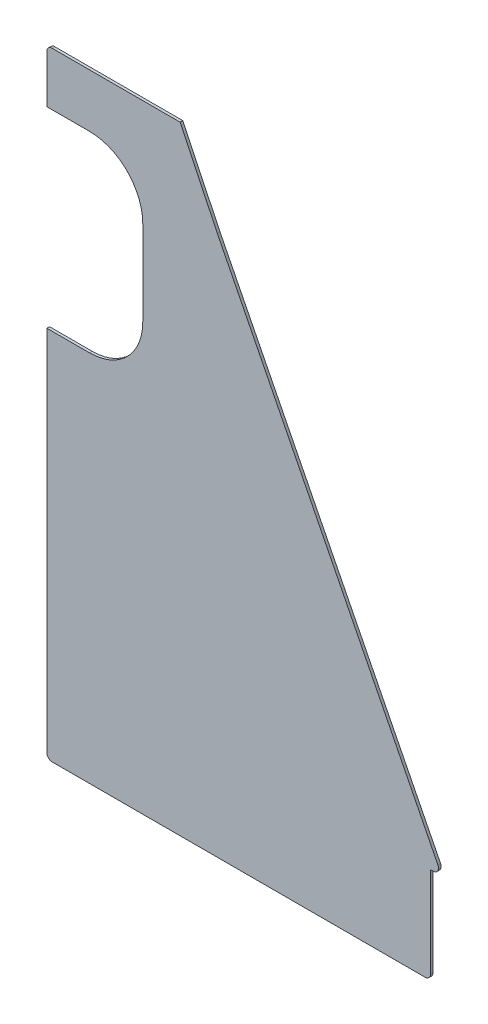
from build123d import *

# Parameters (mm, degrees)
SKETCH1_W           = 720
SKETCH1_H           = 1160
BOSS_EXTRUDE1_DEPTH = 5
FILLET1_R           = 10
CUT_EXTRUDE1_DEPTH  = 683.6602376
SKETCH3_W           = 360
SKETCH3_H           = 360
CUT_EXTRUDE2_DEPTH  = 683.6602376
FILLET2_R           = 100
BOSS_EXTRUDE2_DEPTH = 5
FILLET3_R           = 10


with BuildPart() as part:
    # Sketch1 → Boss-Extrude1 (new body)
    with BuildSketch(Plane.XY):
        Rectangle(SKETCH1_W, SKETCH1_H)
    extrude(amount=BOSS_EXTRUDE1_DEPTH)

    # Fillet1
    fillet1_edges = [part.edges().sort_by_distance(p)[0] for p in [
        (360, -580, 2.5),
        (-360, -580, 2.5),
        (-360, 580, 2.5),
        (360, 580, 2.5),
    ]]
    fillet(fillet1_edges, radius=FILLET1_R)

    # Sketch2 → Cut-Extrude1 (cut, through all)
    with BuildSketch(Plane(origin=(0, 0, 0), x_dir=(-1, 0, 0), z_dir=(0, 0, -1))):
        Polygon((-360, -400), (110, 580), (-360, 580), align=None)
    extrude(amount=-CUT_EXTRUDE1_DEPTH, mode=Mode.SUBTRACT)

    # Sketch3 → Cut-Extrude2 (cut, through all)
    with BuildSketch(Plane.XY.offset(5)):
        with Locations((-360, 300)):
            Rectangle(SKETCH3_W, SKETCH3_H)
    extrude(amount=-CUT_EXTRUDE2_DEPTH, mode=Mode.SUBTRACT)

    # Fillet2
    fillet2_edges = [part.edges().sort_by_distance(p)[0] for p in [
        (-180, 120, 2.5),
        (-180, 480, 2.5),
    ]]
    fillet(fillet2_edges, radius=FILLET2_R)

    # Sketch4 → Boss-Extrude2 (add)
    with BuildSketch(Plane(origin=(0, 0, 0), x_dir=(-1, 0, 0), z_dir=(0, 0, -1))):
        Polygon((-360, -400), (-381.299239221, -400), (39.887910056, 433.808833734), align=None)
    extrude(amount=-BOSS_EXTRUDE2_DEPTH)

    # Fillet3
    fillet3_edges = [part.edges().sort_by_distance(p)[0] for p in [
        (381.299239221, -400, 2.5),
    ]]
    fillet(fillet3_edges, radius=FILLET3_R)


solid = part.part
